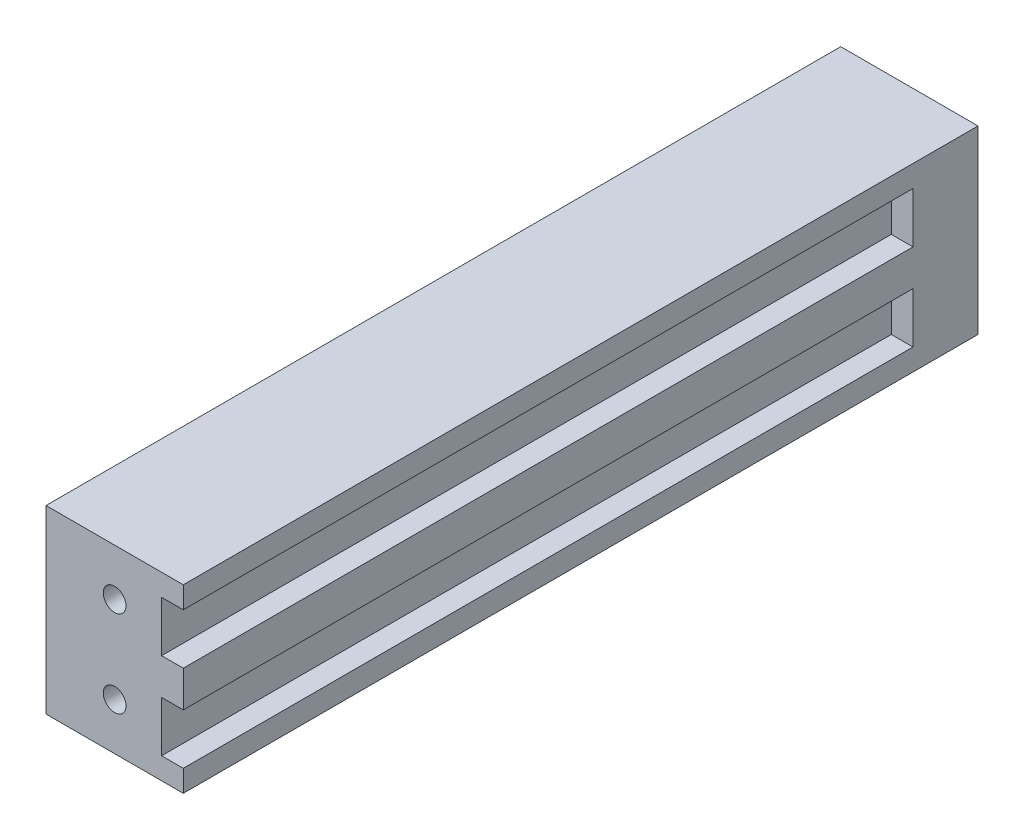
from build123d import *

# Parameters (mm, degrees)
SKETCH1_W                    = 19
SKETCH1_H                    = 110
BLOCK_DEPTH                  = 25
SKETCH2_W                    = 101
SKETCH2_H                    = 7
SLIDES_DEPTH                 = 3
SKETCH3_R                    = 1.5
MOUNTING_HOLES_DEPTH         = 10
SKETCH5_R                    = 1.575
CUT_EXTRUDE1_DEPTH           = 15
CUT_EXTRUDE1_DRAFT           = -1
CUT_EXTRUDE1_PROFILE_2_DEPTH = 15
CUT_EXTRUDE1_PROFILE_2_DRAFT = -1


with BuildPart() as part:
    # Sketch1 → Block (new body)
    with BuildSketch(Plane(origin=(0, 0, 0), x_dir=(1, 0, 0), z_dir=(0, 1, 0))):
        Rectangle(SKETCH1_W, SKETCH1_H)
    extrude(amount=BLOCK_DEPTH)

    # Sketch2 → Slides (cut)
    with BuildSketch(Plane(origin=(9.5, 0, 0), x_dir=(0, 0, -1), z_dir=(1, 0, 0))):
        with Locations((-4.5, 6.5)):
            Rectangle(SKETCH2_W, SKETCH2_H)
        with Locations((-4.5, 18.5)):
            Rectangle(SKETCH2_W, SKETCH2_H)
    extrude(amount=-SLIDES_DEPTH, mode=Mode.SUBTRACT)

    # Sketch3 → Mounting Holes (cut)
    with BuildSketch(Plane.ZY.offset(9.5)):
        with Locations((-50, 6)):
            Circle(SKETCH3_R)
        with Locations((51, 6)):
            Circle(SKETCH3_R)
    extrude(amount=-MOUNTING_HOLES_DEPTH, mode=Mode.SUBTRACT)


with BuildPart() as cut_extrude1_tool:
    # Sketch5 → Cut-Extrude1 (with draft: the straight prism first)
    with BuildSketch(Plane.XY.offset(55)):
        with Locations((0, 18.5)):
            Circle(SKETCH5_R)
    extrude(amount=-CUT_EXTRUDE1_DEPTH)
    # Cut-Extrude1: the draft: its side faces are tilted about the plane it starts from
    cut_extrude1_sides = [cut_extrude1_tool.faces().sort_by_distance(p)[0] for p in [
        (-1.575, 18.5, 47.5),
    ]]
    draft(cut_extrude1_sides, Plane.XY.offset(55), CUT_EXTRUDE1_DRAFT)


with BuildPart() as part_1:
    add(part.part)

    # Cut-Extrude1: cut by cut_extrude1_tool
    add(cut_extrude1_tool.part, mode=Mode.SUBTRACT)


with BuildPart() as cut_extrude1_profile_2_tool:
    # Sketch5 → Cut-Extrude1 profile 2 (with draft: the straight prism first)
    with BuildSketch(Plane.XY.offset(55)):
        with Locations((0, 6.5)):
            Circle(SKETCH5_R)
    extrude(amount=-CUT_EXTRUDE1_PROFILE_2_DEPTH)
    # Cut-Extrude1 profile 2: the draft: its side faces are tilted about the plane it starts from
    cut_extrude1_profile_2_sides = [cut_extrude1_profile_2_tool.faces().sort_by_distance(p)[0] for p in [
        (-1.575, 6.5, 47.5),
    ]]
    draft(cut_extrude1_profile_2_sides, Plane.XY.offset(55), CUT_EXTRUDE1_PROFILE_2_DRAFT)


with BuildPart() as part_2:
    add(part_1.part)

    # Cut-Extrude1 profile 2: cut by cut_extrude1_profile_2_tool
    add(cut_extrude1_profile_2_tool.part, mode=Mode.SUBTRACT)


solid = part_2.part
